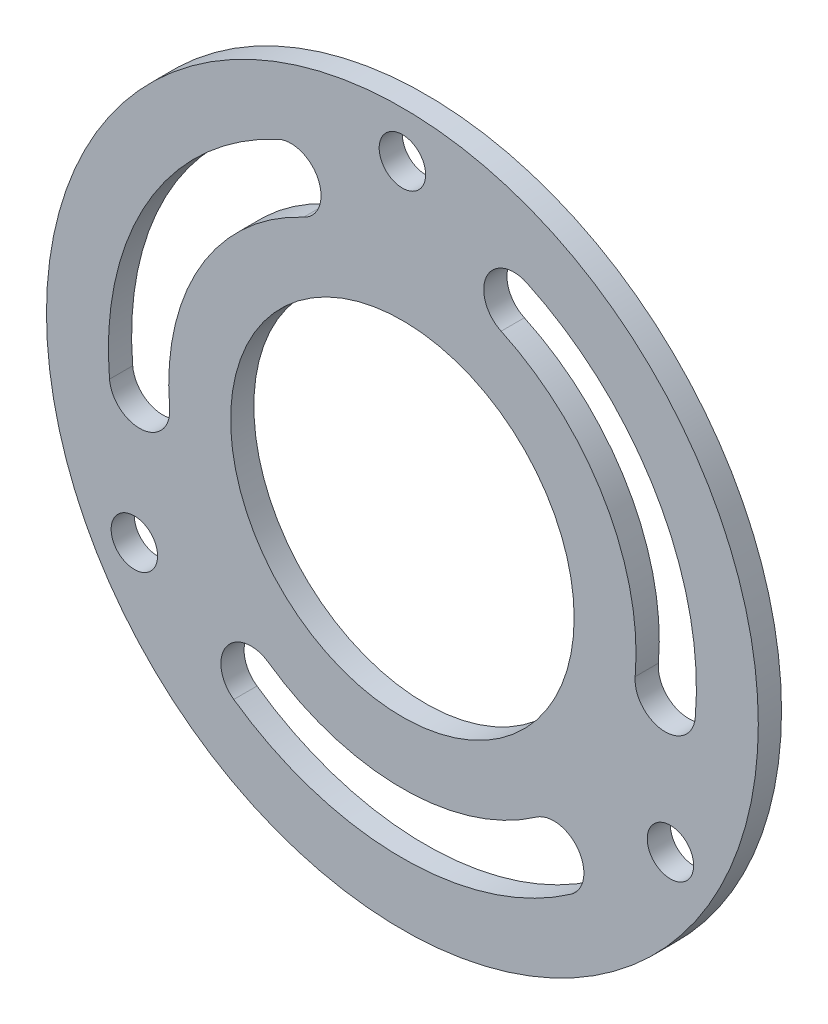
from build123d import *

# Parameters (mm, degrees)
SKETCH_1_R          = 23
SKETCH_1_R_2        = 1.5
SKETCH_1_R_3        = 11.1
EXTRUDE_1_DEPTH     = 1.5
CUT_EXTRUDE_1_DEPTH = 33.56148031


with BuildPart() as part:
    # 草图1 → 凸台-拉伸1 (new body)
    with BuildSketch(Plane.XY):
        Circle(SKETCH_1_R)
        with Locations((0, 20)):
            Circle(SKETCH_1_R_2, mode=Mode.SUBTRACT)
        Circle(SKETCH_1_R_3, mode=Mode.SUBTRACT)
        with Locations((17.320508076, -10)):
            Circle(SKETCH_1_R_2, mode=Mode.SUBTRACT)
        with Locations((-17.320508076, -10)):
            Circle(SKETCH_1_R_2, mode=Mode.SUBTRACT)
    extrude(amount=EXTRUDE_1_DEPTH)

    # 草图2 → 切除-拉伸1 (cut, through all)
    with BuildSketch(Plane.XY.offset(1.5)):
        with BuildLine():
            ThreePointArc((-8.029746973, 17.219847954), (-16.454482672, 9.5), (-18.927699264, -1.655959112))
            ThreePointArc((-18.927699264, -1.655959112), (-16.815165904, -3.428585075), (-15.042539941, -1.316051715))
            ThreePointArc((-15.042539941, -1.316051715), (-13.076983597, 7.55), (-6.381535752, 13.685247584))
            ThreePointArc((-6.381535752, 13.685247584), (-5.438341178, 16.276653379), (-8.029746973, 17.219847954))
        make_face()
        with BuildLine():
            ThreePointArc((18.927699264, -1.655959112), (16.454482672, 9.5), (8.029746973, 17.219847954))
            ThreePointArc((8.029746973, 17.219847954), (5.438341178, 16.276653379), (6.381535752, 13.685247584))
            ThreePointArc((6.381535752, 13.685247584), (13.076983597, 7.55), (15.042539941, -1.316051715))
            ThreePointArc((15.042539941, -1.316051715), (16.815165904, -3.428585075), (18.927699264, -1.655959112))
        make_face()
        with BuildLine():
            ThreePointArc((-10.897952291, -15.563888841), (0, -19), (10.897952291, -15.563888841))
            ThreePointArc((10.897952291, -15.563888841), (11.376824726, -12.848068304), (8.661004189, -12.369195869))
            ThreePointArc((8.661004189, -12.369195869), (0, -15.1), (-8.661004189, -12.369195869))
            ThreePointArc((-8.661004189, -12.369195869), (-11.376824726, -12.848068304), (-10.897952291, -15.563888841))
        make_face()
    extrude(amount=-CUT_EXTRUDE_1_DEPTH, mode=Mode.SUBTRACT)


solid = part.part
